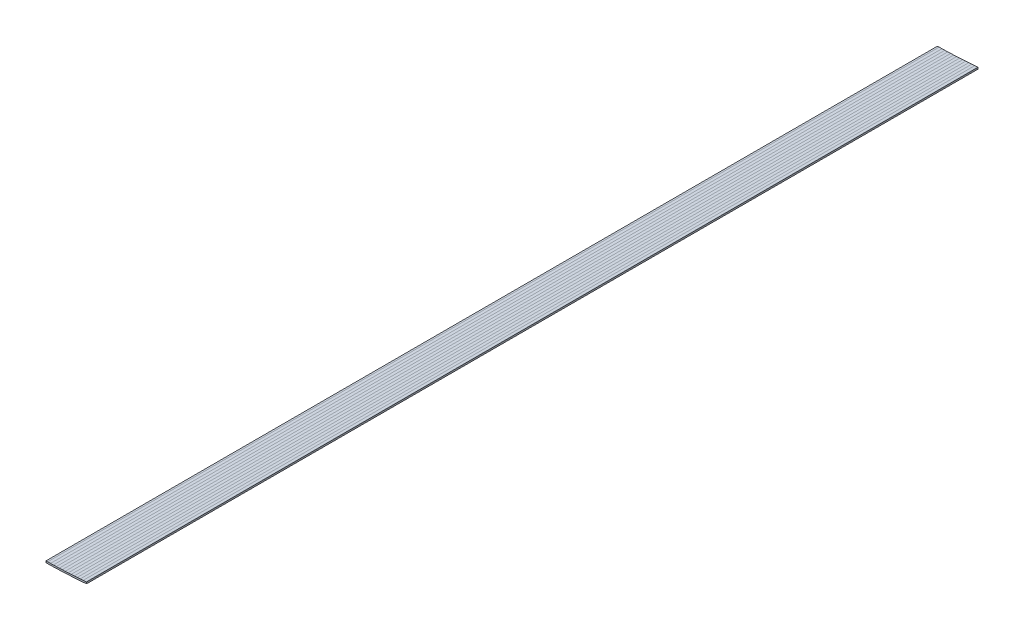
from build123d import *

# Parameters (mm, degrees)
DEFINED_MATERIAL_SECTION_L220_DEPTH = 220


with BuildPart() as part:
    # Sketch1 → Defined_Material_Section_L220 (new body)
    with BuildSketch(Plane.XY):
        Polygon((21.952716474, -1.55131799), (21.214541315, -1.60792765), (20.472974075, -1.662124111), (19.729164078, -1.713644652), (18.984264321, -1.762224717), (18.239429685, -1.807599235), (17.495815146, -1.849504144), (16.754574, -1.887678119), (16.016856081, -1.921864485), (15.28380601, -1.951813275), (14.556561449, -1.977283418), (13.836251383, -1.998044999), (13.123994434, -2.013881565), (12.420897198, -2.024592435), (12, -2.027874417), (12, -1.627862257), (12.41629125, -1.62461619), (13.116502158, -1.61394929), (13.826043272, -1.598173108), (14.543798827, -1.577485157), (15.268641415, -1.552099138), (15.999433548, -1.522242595), (16.735029283, -1.488154573), (17.474275891, -1.450083317), (18.216015579, -1.408284062), (18.959087234, -1.363016942), (19.702328203, -1.314545058), (20.444576084, -1.263132719), (21.184670536, -1.209043894), (21.921455096, -1.152540877), (22, -1.146249586), (22, -1.547530673), align=None)
    extrude(amount=DEFINED_MATERIAL_SECTION_L220_DEPTH)


solid = part.part
